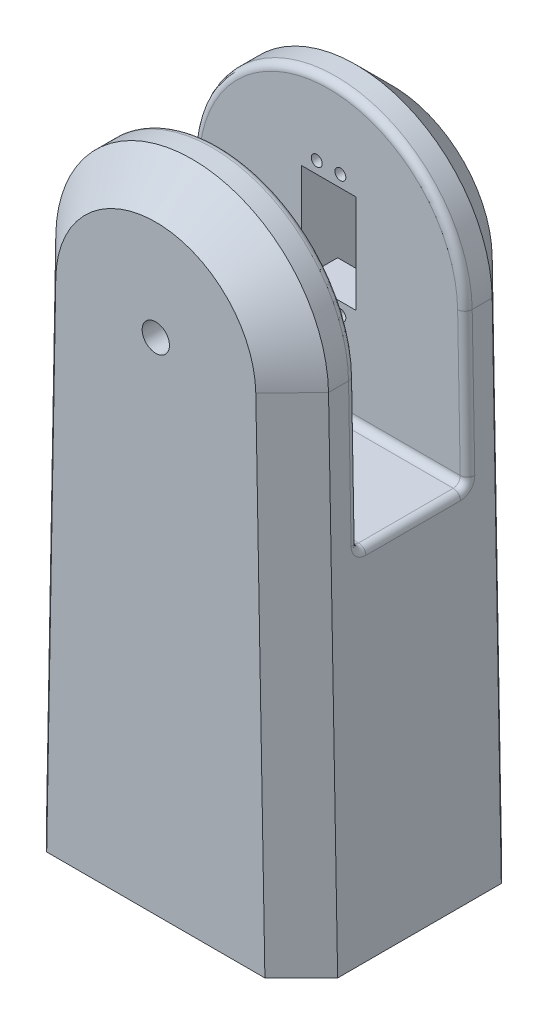
from build123d import *

# Parameters (mm, degrees)
BOSS_EXTRUDE1_DEPTH = 65
CHAMFER1_SIZE       = 10
SKETCH2_R           = 15
CUT_EXTRUDE1_DEPTH  = 5
SKETCH4_R           = 1.5
CUT_EXTRUDE2_DEPTH  = 7.5
FILLET1_R           = 1
SKETCH5_W           = 30
SKETCH5_H           = 78
CUT_EXTRUDE3_DEPTH  = 44.75
FILLET2_R           = 2
SKETCH6_W           = 15
SKETCH6_H           = 40
CUT_EXTRUDE4_DEPTH  = 7.5
SKETCH7_W           = 15
SKETCH7_H           = 27
SKETCH7_R           = 1.5
CUT_EXTRUDE5_DEPTH  = 10
SKETCH8_R           = 3.75
CUT_EXTRUDE6_DEPTH  = 191.918831033


with BuildPart() as part:
    # Sketch1 → Boss-Extrude1 (new body)
    with BuildSketch(Plane.XY):
        with BuildLine():
            Line((-40, 0), (40, 0))
            Line((40, 0), (37.493833718, 138.180024354))
            ThreePointArc((37.493833718, 138.180024354), (0, 175), (-37.493833718, 138.180024354))
            Line((-37.493833718, 138.180024354), (-40, 0))
        make_face()
    extrude(amount=BOSS_EXTRUDE1_DEPTH)

    # Chamfer1
    chamfer1_edges = [part.edges().sort_by_distance(p)[0] for p in [
        (-38.746916859, 69.090012177, 65),
        (38.746916859, 69.090012177, 65),
        (-38.746916859, 69.090012177, 0),
        (0, 175, 0),
        (38.746916859, 69.090012177, 0),
        (0, 175, 65),
    ]]
    chamfer(chamfer1_edges, length=CHAMFER1_SIZE)

    # Sketch2 → Cut-Extrude1 (cut)
    with BuildSketch(Plane(origin=(0, 0, 0), x_dir=(-1, 0, 0), z_dir=(0, -1, 0))):
        with Locations(Location((0, -32.5, 0), (0, 0, 90))):
            Circle(SKETCH2_R)
    extrude(amount=-CUT_EXTRUDE1_DEPTH, mode=Mode.SUBTRACT)

    # Sketch4 → Cut-Extrude2 (cut)
    with BuildSketch(Plane.XZ.offset(-5)):
        with Locations(Location((0, 40, 0), (0, 0, 270))):
            Circle(SKETCH4_R)
        with Locations(Location((7.5, 32.5, 0), (0, 0, 270))):
            Circle(SKETCH4_R)
        with Locations(Location((0, 25, 0), (0, 0, 270))):
            Circle(SKETCH4_R)
        with Locations(Location((-7.5, 32.5, 0), (0, 0, 270))):
            Circle(SKETCH4_R)
    extrude(amount=-CUT_EXTRUDE2_DEPTH, mode=Mode.SUBTRACT)

    # Fillet1
    fillet1_edges = [part.edges().sort_by_distance(p)[0] for p in [
        (0, 5, 47.5),
        (0, 0, 47.5),
    ]]
    fillet(fillet1_edges, radius=FILLET1_R)

    # Sketch5 → Cut-Extrude3 (cut, symmetric)
    with BuildSketch(Plane(origin=(0, 0, 0), x_dir=(0, 0, -1), z_dir=(1, 0, 0))):
        with Locations((-32.5, 136)):
            Rectangle(SKETCH5_W, SKETCH5_H)
    extrude(amount=CUT_EXTRUDE3_DEPTH, both=True, mode=Mode.SUBTRACT)

    # Fillet2
    fillet2_edges = [part.edges().sort_by_distance(p)[0] for p in [
        (-38.240714383, 97, 32.5),
        (-37.867274051, 117.590012177, 47.5),
        (-37.867274051, 117.590012177, 17.5),
        (0, 97, 17.5),
        (37.867274051, 117.590012177, 17.5),
        (0, 175, 17.5),
        (0, 175, 47.5),
        (37.867274051, 117.590012177, 47.5),
        (0, 97, 47.5),
        (38.240714383, 97, 32.5),
    ]]
    fillet(fillet2_edges, radius=FILLET2_R)

    # Sketch6 → Cut-Extrude4 (cut)
    with BuildSketch(Plane(origin=(0, 0, 0), x_dir=(-1, 0, 0), z_dir=(0, 0, -1))):
        with Locations((0, 137.5)):
            Rectangle(SKETCH6_W, SKETCH6_H)
    extrude(amount=-CUT_EXTRUDE4_DEPTH, mode=Mode.SUBTRACT)

    # Sketch7 → Cut-Extrude5 (cut)
    with BuildSketch(Plane(origin=(0, 0, 7.5), x_dir=(-1, 0, 0), z_dir=(0, 0, -1))):
        with Locations((0, 137.5)):
            Rectangle(SKETCH7_W, SKETCH7_H)
        with Locations(Location((-3.25, 154.25, 0), (0, 0, 90))):
            Circle(SKETCH7_R)
        with Locations(Location((3.25, 154.25, 0), (0, 0, 90))):
            Circle(SKETCH7_R)
        with Locations(Location((-3.25, 120.75, 0), (0, 0, 90))):
            Circle(SKETCH7_R)
        with Locations(Location((3.25, 120.75, 0), (0, 0, 90))):
            Circle(SKETCH7_R)
    extrude(amount=-CUT_EXTRUDE5_DEPTH, mode=Mode.SUBTRACT)

    # Sketch8 → Cut-Extrude6 (cut, through all)
    with BuildSketch(Plane(origin=(0, 0, 0), x_dir=(-1, 0, 0), z_dir=(0, 0, -1))):
        with Locations((0, 137.5)):
            Circle(SKETCH8_R)
    extrude(amount=-CUT_EXTRUDE6_DEPTH, mode=Mode.SUBTRACT)


solid = part.part
